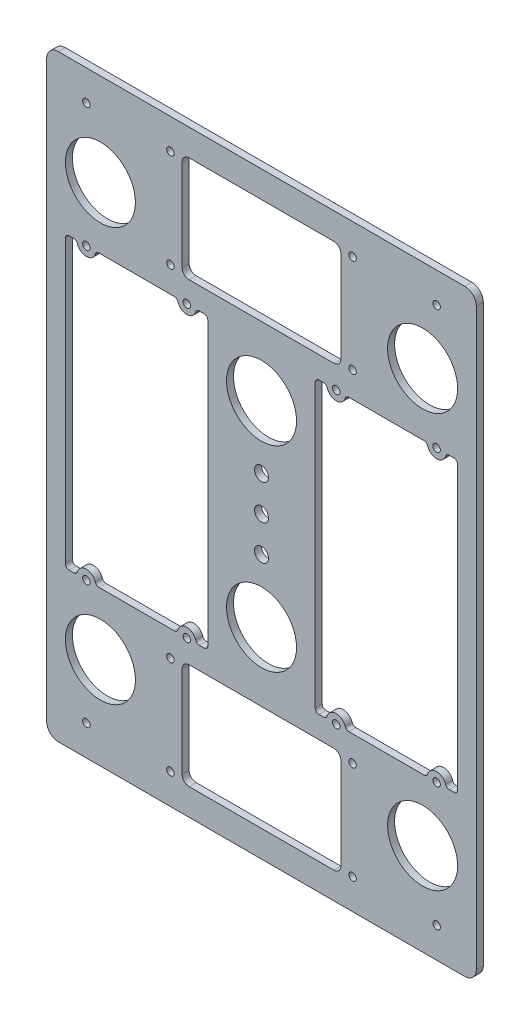
from build123d import *

# Parameters (mm, degrees)
MODEL_R             = 1.6
MODEL_R_2           = 3
MODEL_R_3           = 15
BOSS_EXTRUDE1_DEPTH = 1.5


with BuildPart() as part:
    # Model → Boss-Extrude1 (new, symmetric)
    with BuildSketch(Plane.XY):
        with BuildLine():
            Line((-87, -128), (87, -128))
            ThreePointArc((87, -128), (90.535533906, -126.535533906), (92, -123))
            Line((92, -123), (92, 123))
            ThreePointArc((92, 123), (90.535533906, 126.535533906), (87, 128))
            Line((87, 128), (-87, 128))
            ThreePointArc((-87, 128), (-90.535533906, 126.535533906), (-92, 123))
            Line((-92, 123), (-92, -123))
            ThreePointArc((-92, -123), (-90.535533906, -126.535533906), (-87, -128))
        make_face()
        with Locations((-75, 62)):
            Circle(MODEL_R, mode=Mode.SUBTRACT)
        with Locations((-32, 62)):
            Circle(MODEL_R, mode=Mode.SUBTRACT)
        with Locations((-75, -62)):
            Circle(MODEL_R, mode=Mode.SUBTRACT)
        with Locations((-32, -62)):
            Circle(MODEL_R, mode=Mode.SUBTRACT)
        with Locations((32, 62)):
            Circle(MODEL_R, mode=Mode.SUBTRACT)
        with Locations((75, 62)):
            Circle(MODEL_R, mode=Mode.SUBTRACT)
        with Locations((32, -62)):
            Circle(MODEL_R, mode=Mode.SUBTRACT)
        with Locations((75, -62)):
            Circle(MODEL_R, mode=Mode.SUBTRACT)
        with Locations((-39, 115)):
            Circle(MODEL_R, mode=Mode.SUBTRACT)
        with Locations((-39, 73)):
            Circle(MODEL_R, mode=Mode.SUBTRACT)
        with Locations((39, 115)):
            Circle(MODEL_R, mode=Mode.SUBTRACT)
        with Locations((39, 73)):
            Circle(MODEL_R, mode=Mode.SUBTRACT)
        with Locations((-39, -115)):
            Circle(MODEL_R, mode=Mode.SUBTRACT)
        with Locations((-39, -73)):
            Circle(MODEL_R, mode=Mode.SUBTRACT)
        with Locations((39, -115)):
            Circle(MODEL_R, mode=Mode.SUBTRACT)
        with Locations((39, -73)):
            Circle(MODEL_R, mode=Mode.SUBTRACT)
        Circle(MODEL_R_2, mode=Mode.SUBTRACT)
        with Locations((0, 15)):
            Circle(MODEL_R_2, mode=Mode.SUBTRACT)
        with Locations((0, -15)):
            Circle(MODEL_R_2, mode=Mode.SUBTRACT)
        with Locations((0, 42)):
            Circle(MODEL_R_3, mode=Mode.SUBTRACT)
        with Locations((0, -42)):
            Circle(MODEL_R_3, mode=Mode.SUBTRACT)
        with Locations((-75, 115)):
            Circle(MODEL_R, mode=Mode.SUBTRACT)
        with Locations((75, 115)):
            Circle(MODEL_R, mode=Mode.SUBTRACT)
        with Locations((-75, -115)):
            Circle(MODEL_R, mode=Mode.SUBTRACT)
        with Locations((75, -115)):
            Circle(MODEL_R, mode=Mode.SUBTRACT)
        with Locations((-69, 88.5)):
            Circle(MODEL_R_3, mode=Mode.SUBTRACT)
        with Locations((69, 88.5)):
            Circle(MODEL_R_3, mode=Mode.SUBTRACT)
        with Locations((-69, -88.5)):
            Circle(MODEL_R_3, mode=Mode.SUBTRACT)
        with Locations((69, -88.5)):
            Circle(MODEL_R_3, mode=Mode.SUBTRACT)
        with BuildLine():
            Line((-80.366563146, 62), (-82.4, 62))
            ThreePointArc((-82.4, 62), (-83.53137085, 61.53137085), (-84, 60.4))
            Line((-84, 60.4), (-84, -60.4))
            ThreePointArc((-84, -60.4), (-83.53137085, -61.53137085), (-82.4, -62))
            Line((-82.4, -62), (-80.366563146, -62))
            ThreePointArc((-80.366563146, -62), (-79.410380259, -61.682853961), (-78.83325939, -60.857142857))
            ThreePointArc((-78.83325939, -60.857142857), (-75, -58), (-71.16674061, -60.857142857))
            ThreePointArc((-71.16674061, -60.857142857), (-70.589619741, -61.682853961), (-69.633436854, -62))
            Line((-69.633436854, -62), (-37.366563146, -62))
            ThreePointArc((-37.366563146, -62), (-36.410380259, -61.682853961), (-35.83325939, -60.857142857))
            ThreePointArc((-35.83325939, -60.857142857), (-32, -58), (-28.16674061, -60.857142857))
            ThreePointArc((-28.16674061, -60.857142857), (-27.589619741, -61.682853961), (-26.633436854, -62))
            Line((-26.633436854, -62), (-24.6, -62))
            ThreePointArc((-24.6, -62), (-23.46862915, -61.53137085), (-23, -60.4))
            Line((-23, -60.4), (-23, 60.4))
            ThreePointArc((-23, 60.4), (-23.46862915, 61.53137085), (-24.6, 62))
            Line((-24.6, 62), (-26.633436854, 62))
            ThreePointArc((-26.633436854, 62), (-27.589619741, 61.682853961), (-28.16674061, 60.857142857))
            ThreePointArc((-28.16674061, 60.857142857), (-32, 58), (-35.83325939, 60.857142857))
            ThreePointArc((-35.83325939, 60.857142857), (-36.410380259, 61.682853961), (-37.366563146, 62))
            Line((-37.366563146, 62), (-69.633436854, 62))
            ThreePointArc((-69.633436854, 62), (-70.589619741, 61.682853961), (-71.16674061, 60.857142857))
            ThreePointArc((-71.16674061, 60.857142857), (-75, 58), (-78.83325939, 60.857142857))
            ThreePointArc((-78.83325939, 60.857142857), (-79.410380259, 61.682853961), (-80.366563146, 62))
        make_face(mode=Mode.SUBTRACT)
        with BuildLine():
            Line((26.633436854, 62), (24.6, 62))
            ThreePointArc((24.6, 62), (23.46862915, 61.53137085), (23, 60.4))
            Line((23, 60.4), (23, -60.4))
            ThreePointArc((23, -60.4), (23.46862915, -61.53137085), (24.6, -62))
            Line((24.6, -62), (26.633436854, -62))
            ThreePointArc((26.633436854, -62), (27.589619741, -61.682853961), (28.16674061, -60.857142857))
            ThreePointArc((28.16674061, -60.857142857), (32, -58), (35.83325939, -60.857142857))
            ThreePointArc((35.83325939, -60.857142857), (36.410380259, -61.682853961), (37.366563146, -62))
            Line((37.366563146, -62), (69.633436854, -62))
            ThreePointArc((69.633436854, -62), (70.589619741, -61.682853961), (71.16674061, -60.857142857))
            ThreePointArc((71.16674061, -60.857142857), (75, -58), (78.83325939, -60.857142857))
            ThreePointArc((78.83325939, -60.857142857), (79.410380259, -61.682853961), (80.366563146, -62))
            Line((80.366563146, -62), (82.4, -62))
            ThreePointArc((82.4, -62), (83.53137085, -61.53137085), (84, -60.4))
            Line((84, -60.4), (84, 60.4))
            ThreePointArc((84, 60.4), (83.53137085, 61.53137085), (82.4, 62))
            Line((82.4, 62), (80.366563146, 62))
            ThreePointArc((80.366563146, 62), (79.410380259, 61.682853961), (78.83325939, 60.857142857))
            ThreePointArc((78.83325939, 60.857142857), (75, 58), (71.16674061, 60.857142857))
            ThreePointArc((71.16674061, 60.857142857), (70.589619741, 61.682853961), (69.633436854, 62))
            Line((69.633436854, 62), (37.366563146, 62))
            ThreePointArc((37.366563146, 62), (36.410380259, 61.682853961), (35.83325939, 60.857142857))
            ThreePointArc((35.83325939, 60.857142857), (32, 58), (28.16674061, 60.857142857))
            ThreePointArc((28.16674061, 60.857142857), (27.589619741, 61.682853961), (26.633436854, 62))
        make_face(mode=Mode.SUBTRACT)
        with BuildLine():
            Line((34, 113.6), (34, 74.4))
            ThreePointArc((34, 74.4), (33.121320344, 72.278679656), (31, 71.4))
            Line((31, 71.4), (-31, 71.4))
            ThreePointArc((-31, 71.4), (-33.121320344, 72.278679656), (-34, 74.4))
            Line((-34, 74.4), (-34, 113.6))
            ThreePointArc((-34, 113.6), (-33.121320344, 115.721320344), (-31, 116.6))
            Line((-31, 116.6), (31, 116.6))
            ThreePointArc((31, 116.6), (33.121320344, 115.721320344), (34, 113.6))
        make_face(mode=Mode.SUBTRACT)
        with BuildLine():
            Line((34, -113.6), (34, -74.4))
            ThreePointArc((34, -74.4), (33.121320344, -72.278679656), (31, -71.4))
            Line((31, -71.4), (-31, -71.4))
            ThreePointArc((-31, -71.4), (-33.121320344, -72.278679656), (-34, -74.4))
            Line((-34, -74.4), (-34, -113.6))
            ThreePointArc((-34, -113.6), (-33.121320344, -115.721320344), (-31, -116.6))
            Line((-31, -116.6), (31, -116.6))
            ThreePointArc((31, -116.6), (33.121320344, -115.721320344), (34, -113.6))
        make_face(mode=Mode.SUBTRACT)
    extrude(amount=BOSS_EXTRUDE1_DEPTH, both=True)


solid = part.part
